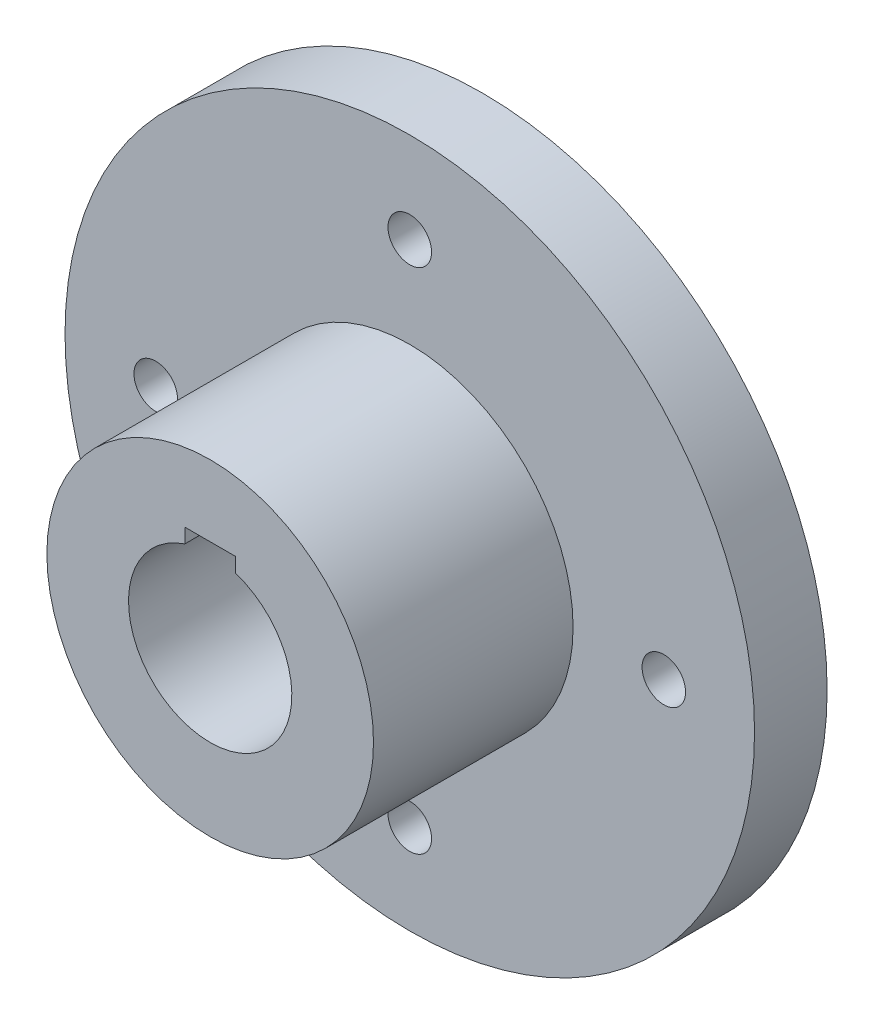
from build123d import *

# Parameters (mm, degrees)
SKETCH1_R           = 95
BOSS_EXTRUDE1_DEPTH = 20
SKETCH2_R           = 6
CUT_EXTRUDE1_DEPTH  = 20
SKETCH5_R           = 45
BOSS_EXTRUDE3_DEPTH = 55
CUT_EXTRUDE4_DEPTH  = 75


with BuildPart() as part:
    # Sketch1 → Boss-Extrude1 (new body)
    with BuildSketch(Plane.XY):
        Circle(SKETCH1_R)
    extrude(amount=BOSS_EXTRUDE1_DEPTH)

    # Sketch2 → Cut-Extrude1 (cut)
    with BuildSketch(Plane(origin=(0, 0, 0), x_dir=(-1, 0, 0), z_dir=(0, 0, -1))):
        with Locations((0, 70)):
            Circle(SKETCH2_R)
        with Locations((70, 0)):
            Circle(SKETCH2_R)
        with Locations(Location((0, -70, 0), (0, 0, 180))):
            Circle(SKETCH2_R)
        with Locations(Location((-70, 0, 0), (0, 0, 180))):
            Circle(SKETCH2_R)
    extrude(amount=-CUT_EXTRUDE1_DEPTH, mode=Mode.SUBTRACT)

    # Sketch5 → Boss-Extrude3 (add)
    with BuildSketch(Plane.XY.offset(20)):
        Circle(SKETCH5_R)
    extrude(amount=BOSS_EXTRUDE3_DEPTH)

    # Sketch3 → Cut-Extrude4 (cut)
    with BuildSketch(Plane(origin=(0, 0, 0), x_dir=(-1, 0, 0), z_dir=(0, 0, -1))):
        with BuildLine():
            Line((-7, 22.5), (-7, 21.38340478))
            ThreePointArc((-7, 21.38340478), (0, -22.5), (7, 21.38340478))
            Line((7, 21.38340478), (7, 22.5))
            Line((7, 22.5), (7, 25.4))
            Line((7, 25.4), (-7, 25.4))
            Line((-7, 25.4), (-7, 22.5))
        make_face()
    extrude(amount=-CUT_EXTRUDE4_DEPTH, mode=Mode.SUBTRACT)


solid = part.part
